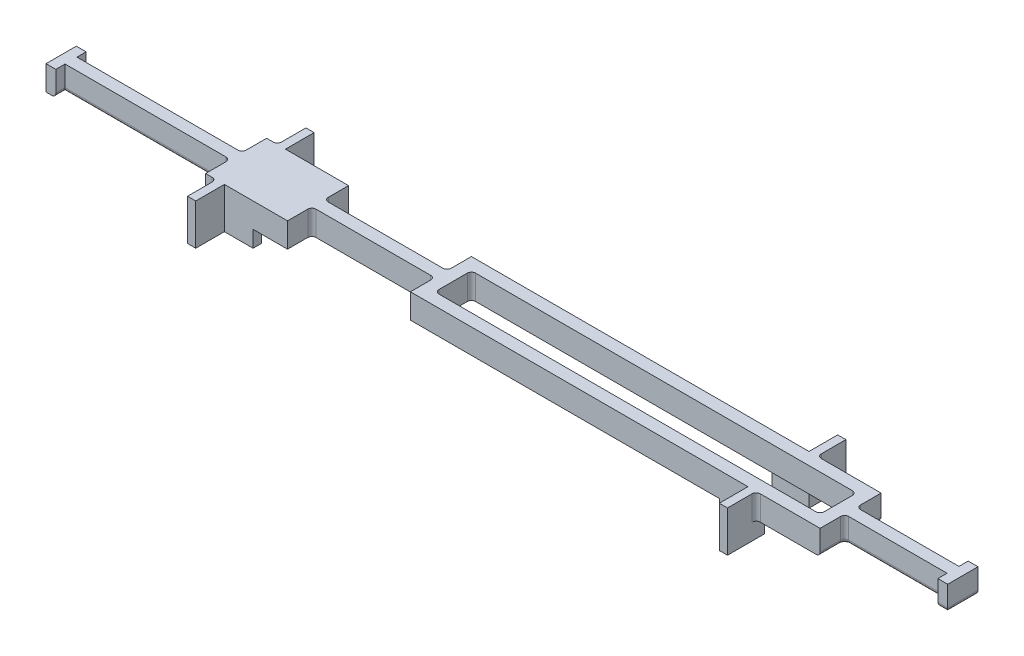
from build123d import *

# Parameters (mm, degrees)
SKETCH1_W           = 94
SKETCH1_H           = 8.9
BOSS_EXTRUDE1_DEPTH = 6
BOSS_EXTRUDE2_DEPTH = 10
FILLET1_R           = 1


with BuildPart() as part:
    # Sketch1 → Boss-Extrude1 (new body)
    with BuildSketch(Plane(origin=(0, 0, 0), x_dir=(1, 0, 0), z_dir=(0, 1, 0))):
        Polygon((106.5, 2.9), (106.5, 5.15), (108.9, 5.15), (108.9, -2.25), (106.5, -2.25), (106.5, 0), (81.5, 0), (81.5, -6), (-18.5, -6), (-18.5, -0.05), (-48.5, -0.05), (-48.5, -6), (-68.5, -6), (-68.5, 0), (-108.8, 0), (-108.8, -2.25), (-111.2, -2.25), (-111.2, 5.15), (-108.8, 5.15), (-108.8, 2.9), (-68.5, 2.9), (-68.5, 8.9), (-48.5, 8.9), (-48.5, 2.95), (-18.5, 2.95), (-18.5, 8.9), (81.5, 8.9), (81.5, 2.9), align=None)
        with Locations((31.5, 1.45)):
            Rectangle(SKETCH1_W, SKETCH1_H, mode=Mode.SUBTRACT)
    extrude(amount=BOSS_EXTRUDE1_DEPTH)

    # Sketch2 → Boss-Extrude2 (add)
    with BuildSketch(Plane(origin=(0, 6, 0), x_dir=(1, 0, 0), z_dir=(0, 1, 0))):
        Polygon((-65.9, 6.9), (-65.9, 15.9), (-63.9, 15.9), (-63.9, 8.9), (-56.9, 8.9), (-56.9, 6.9), align=None)
        Polygon((-65.9, -4), (-56.9, -4), (-56.9, -6), (-63.9, -6), (-63.9, -13), (-65.9, -13), align=None)
        Polygon((65.9, -13), (65.9, -4), (56.9, -4), (56.9, -6), (63.9, -6), (63.9, -13), align=None)
        Polygon((56.9, 6.9), (65.9, 6.9), (65.9, 15.9), (63.9, 15.9), (63.9, 8.9), (56.9, 8.9), align=None)
    extrude(amount=-BOSS_EXTRUDE2_DEPTH)

    # Fillet1
    fillet1_edges = [part.edges().sort_by_distance(p)[0] for p in [
        (-68.5, 0, 3),
        (-68.5, 0, -5.9),
        (-108.8, 0, -4.025),
        (-108.8, 0, 1.125),
        (-68.5, 3, 0),
        (-68.5, 3, -2.9),
        (-88.65, 0, 0),
        (-88.65, 0, -2.9),
        (81.5, 0, -5.9),
        (81.5, 0, 3),
        (78.5, 3, -5.9),
        (78.5, 3, 3),
        (-15.5, 3, 3),
        (-15.5, 3, -5.9),
        (-18.5, 3, -2.95),
        (-18.5, 3, 0.05),
        (-48.5, 3, -2.95),
        (-48.5, 3, 0.05),
        (-65.9, 3, 6),
        (-65.9, 3, -8.9),
        (65.9, 3, -8.9),
        (65.9, 3, 6),
        (81.5, 3, -2.9),
        (81.5, 3, 0),
        (106.5, 0, 1.125),
        (107.7, 0, 2.25),
        (108.9, 0, -1.45),
        (107.7, 0, -5.15),
        (106.5, 0, -4.025),
        (94, 0, -2.9),
        (94, 0, 0),
    ]]
    fillet(fillet1_edges, radius=FILLET1_R)


solid = part.part
